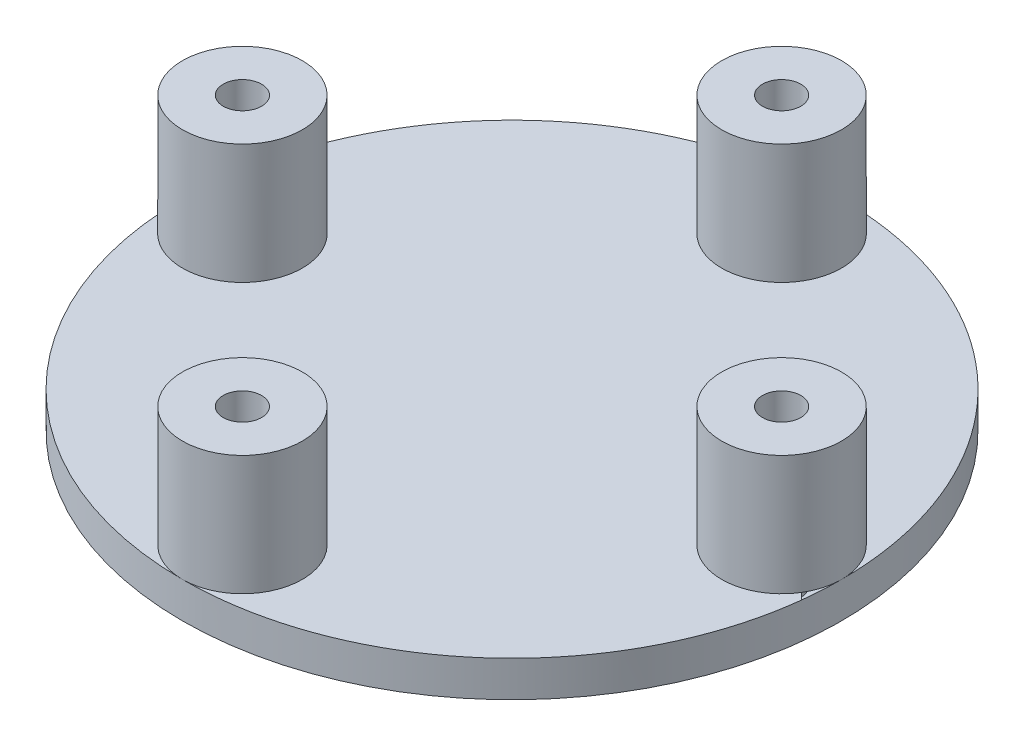
from build123d import *

# Parameters (mm, degrees)
SKETCH1_R           = 27.5
BOSS_EXTRUDE1_DEPTH = 3
SKETCH3_R           = 5
BOSS_EXTRUDE2_DEPTH = 10
SKETCH4_R           = 1.6
CUT_EXTRUDE1_DEPTH  = 42.006097108


with BuildPart() as part:
    # Sketch1 → Boss-Extrude1 (new body)
    with BuildSketch(Plane(origin=(0, 0, 0), x_dir=(1, 0, 0), z_dir=(0, 1, 0))):
        with Locations(Location((0, 0, 0), (0, 0, 270))):
            Circle(SKETCH1_R)
    extrude(amount=BOSS_EXTRUDE1_DEPTH)

    # Sketch3 → Boss-Extrude2 (add)
    with BuildSketch(Plane(origin=(0, 3, 0), x_dir=(1, 0, 0), z_dir=(0, 1, 0))):
        with Locations(Location((0, 22.5, 0), (0, 0, 89.999599385))):
            Circle(SKETCH3_R)
        with Locations(Location((22.5, 0, 0), (0, 0, 359.999599385))):
            Circle(SKETCH3_R)
        with Locations(Location((0, -22.5, 0), (0, 0, 269.999599385))):
            Circle(SKETCH3_R)
        with Locations(Location((-22.5, 0, 0), (0, 0, 179.999599385))):
            Circle(SKETCH3_R)
    extrude(amount=BOSS_EXTRUDE2_DEPTH)

    # Sketch4 → Cut-Extrude1 (cut, through all)
    with BuildSketch(Plane(origin=(0, 13, 0), x_dir=(1, 0, 0), z_dir=(0, 1, 0))):
        with Locations(Location((0, 22.5, 0), (0, 0, 270))):
            Circle(SKETCH4_R)
        with Locations(Location((22.5, 0, 0), (0, 0, 270))):
            Circle(SKETCH4_R)
        with Locations(Location((0, -22.5, 0), (0, 0, 270))):
            Circle(SKETCH4_R)
        with Locations(Location((-22.5, 0, 0), (0, 0, 270))):
            Circle(SKETCH4_R)
    extrude(amount=-CUT_EXTRUDE1_DEPTH, mode=Mode.SUBTRACT)


solid = part.part
